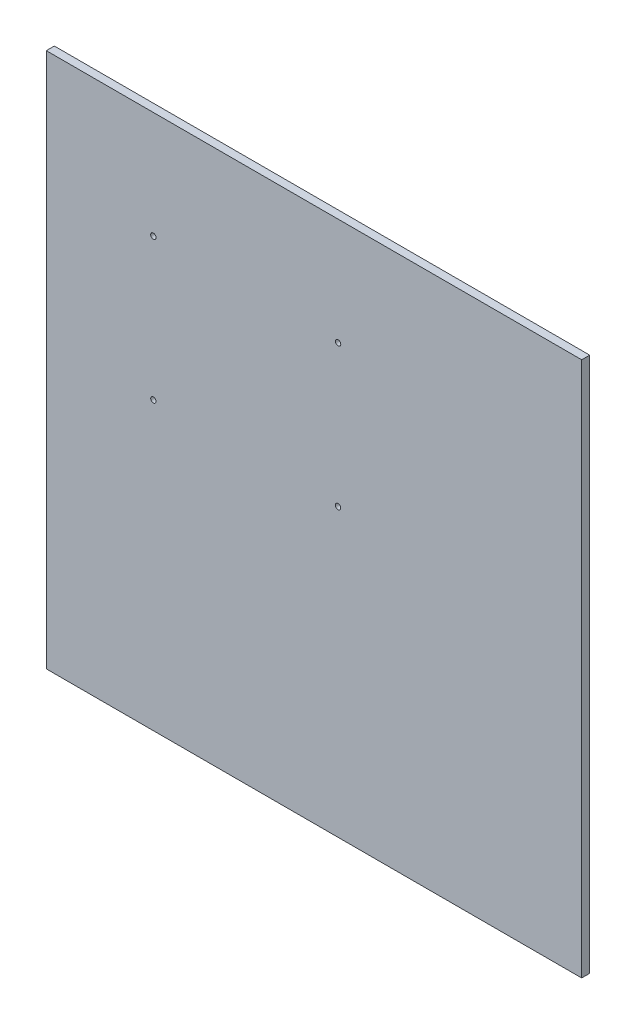
from build123d import *

# Parameters (mm, degrees)
SKICA1_W                 = 200
SKICA1_H                 = 200
P_IDAT_VYSUNUT_M1_DEPTH  = 3
SKICA2_R                 = 1
ODEBRAT_VYSUNUT_M1_DEPTH = 2


with BuildPart() as part:
    # Skica1 → Přidat vysunutím1 (new body)
    with BuildSketch(Plane.XY):
        with Locations((100, 100)):
            Rectangle(SKICA1_W, SKICA1_H)
    extrude(amount=P_IDAT_VYSUNUT_M1_DEPTH)

    # Skica2 → Odebrat vysunutím1 (cut)
    with BuildSketch(Plane.XY.offset(3)):
        with Locations((40, 160)):
            Circle(SKICA2_R)
        with Locations((109, 160)):
            Circle(SKICA2_R)
        with Locations((109, 107)):
            Circle(SKICA2_R)
        with Locations((40, 107)):
            Circle(SKICA2_R)
    extrude(amount=-ODEBRAT_VYSUNUT_M1_DEPTH, mode=Mode.SUBTRACT)


solid = part.part
